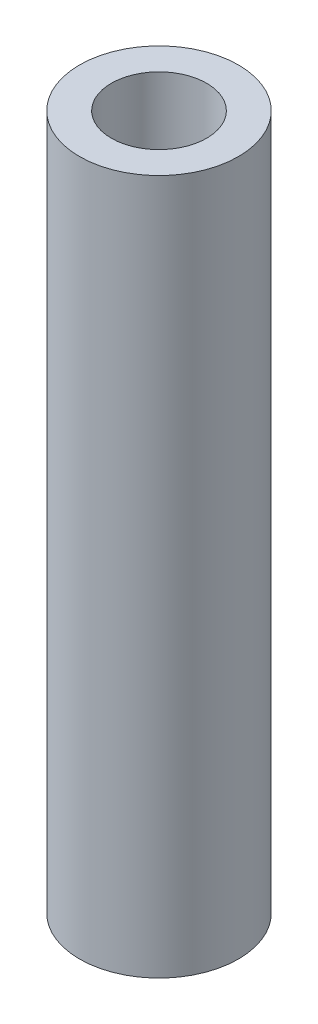
from build123d import *

# Parameters (mm, degrees)
SKETCH_1_R      = 4
SKETCH_1_R_2    = 2.4
EXTRUDE_1_DEPTH = 35


with BuildPart() as part:
    # 草图1 → 凸台-拉伸1 (new body)
    with BuildSketch(Plane(origin=(0, 0, 0), x_dir=(1, 0, 0), z_dir=(0, 1, 0))):
        with Locations(Location((0, 0, 0), (0, 0, 270))):
            Circle(SKETCH_1_R)
        with Locations(Location((0, 0, 0), (0, 0, 270))):
            Circle(SKETCH_1_R_2, mode=Mode.SUBTRACT)
    extrude(amount=EXTRUDE_1_DEPTH)


solid = part.part
